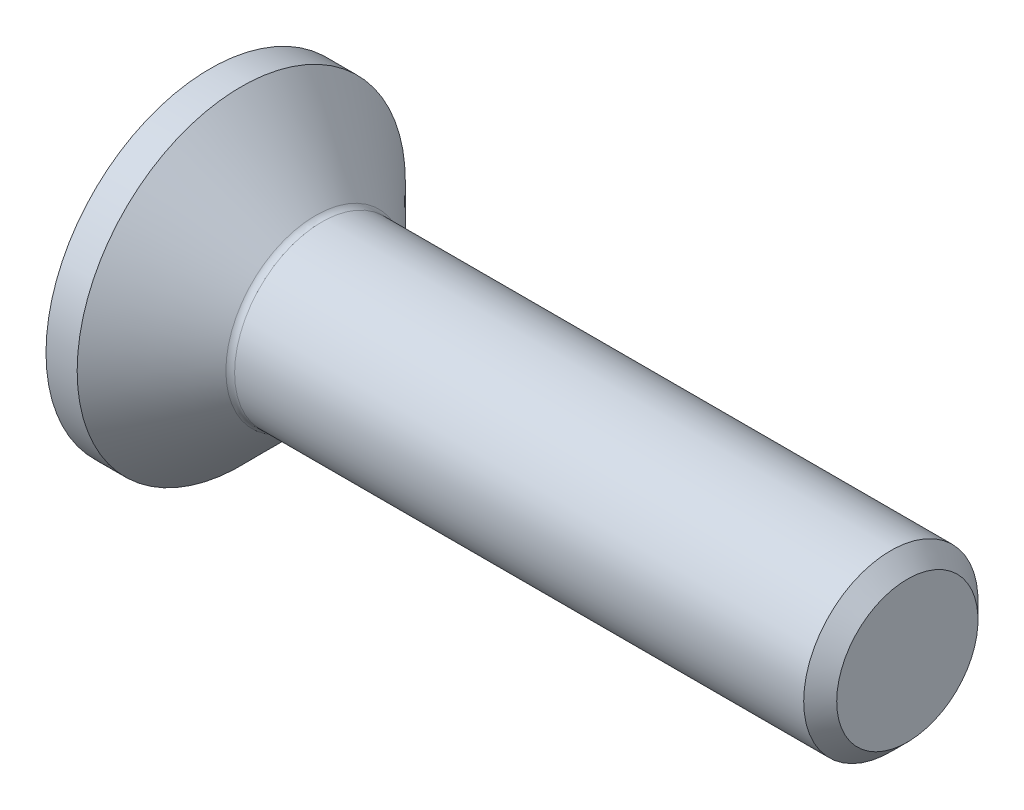
from build123d import *

# Parameters (mm, degrees)
HEXAGONSOCKET_DEPTH = 1.5
HEADFILLET_R        = 0.2
CHAMFER_2_SIZE      = 0.379
SKETCH4_W           = 5
SKETCH4_H           = 5


with BuildPart() as part:
    # Sketch1 → Base (revolve)
    with BuildSketch(Plane.XY, mode=Mode.PRIVATE) as base_sk:
        Polygon((0, 0), (0, 4.48), (2.48, 2), (16, 2), (16, 0), align=None)
    revolve(base_sk.sketch.rotate(Axis((-0.587069181, 0, 0), (1, 0, 0)), 90), axis=Axis((-0.587069181, 0, 0), (1, 0, 0)))

    # Sketch2 → HexagonSocket (cut)
    with BuildSketch(Plane(origin=(0, 0, 0), x_dir=(0, 0, -1), z_dir=(1, 0, 0))):
        Polygon((1.443375673, 0), (0.721687836, 1.25), (-0.721687836, 1.25), (-1.443375673, 0), (-0.721687836, -1.25), (0.721687836, -1.25), align=None)
    extrude(amount=HEXAGONSOCKET_DEPTH, mode=Mode.SUBTRACT)

    # Sketch3 → Cut-Revolve1 (revolve, cut)
    with BuildSketch(Plane.XY, mode=Mode.PRIVATE) as cut_revolve1_sk:
        Polygon((1.5, 1.25), (2.221687836, 0), (1.5, 0), align=None)
    revolve(cut_revolve1_sk.sketch.rotate(Axis((-0.439109555, 0, 0), (1, 0, 0)), 90), axis=Axis((-0.439109555, 0, 0), (1, 0, 0)), mode=Mode.SUBTRACT)

    # HeadFillet
    headfillet_edges = [part.edges().sort_by_distance(p)[0] for p in [
        (2.48, 0, -2),
    ]]
    fillet(headfillet_edges, radius=HEADFILLET_R)

    # Chamfer 2
    chamfer_2_edges = [part.edges().sort_by_distance(p)[0] for p in [
        (16, 0, -2),
    ]]
    chamfer(chamfer_2_edges, length=CHAMFER_2_SIZE)

    # Sketch4 → Cut-Revolve2 (revolve, cut)
    with BuildSketch(Plane(origin=(0, 0, 0), x_dir=(1, 0, 0), z_dir=(0, 1, 0)), mode=Mode.PRIVATE) as cut_revolve2_sk:
        with Locations((0.5, 6.265)):
            Rectangle(SKETCH4_W, SKETCH4_H)
    revolve(cut_revolve2_sk.sketch.rotate(Axis((11.853138686, 0, 0), (-1, 0, 0)), 180), axis=Axis((11.853138686, 0, 0), (-1, 0, 0)), mode=Mode.SUBTRACT)


solid = part.part
